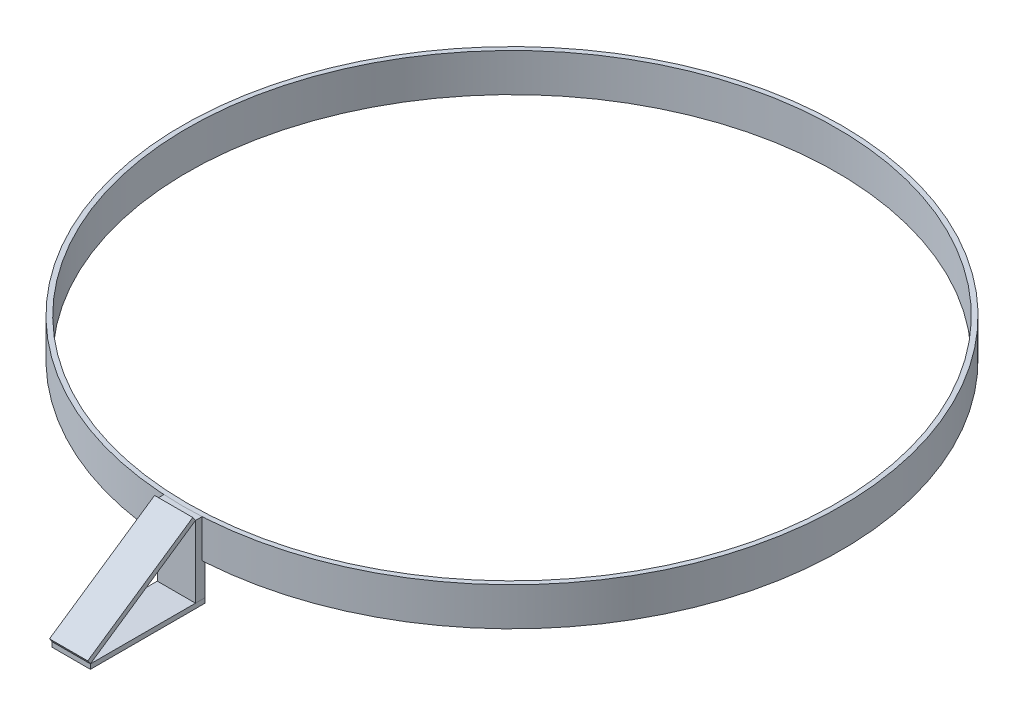
from build123d import *

# Parameters (mm, degrees)
SKETCH1_R            = 219.075
BOSS_EXTRUDE1_DEPTH  = 25.4
SKETCH2_R            = 215.9
CUT_EXTRUDE1_DEPTH   = 311.858281617
SKETCH7_W            = 25.4
SKETCH7_H            = 6.35
BOSS_EXTRUDE7_DEPTH  = 50.8
SKETCH13_W           = 25.4
SKETCH13_H           = 76.2
BOSS_EXTRUDE11_DEPTH = 3.175
SKETCH22_W           = 84.540896168
SKETCH22_H           = 25.4
BOSS_EXTRUDE12_DEPTH = 3.175


with BuildPart() as part:
    # Sketch1 → Boss-Extrude1 (new body)
    with BuildSketch(Plane(origin=(0, 0, 0), x_dir=(1, 0, 0), z_dir=(0, 1, 0))):
        with Locations(Location((0, 0, 0), (0, 0, 270))):
            Circle(SKETCH1_R)
    extrude(amount=BOSS_EXTRUDE1_DEPTH)

    # Sketch2 → Cut-Extrude1 (cut, through all)
    with BuildSketch(Plane(origin=(0, 25.4, 0), x_dir=(1, 0, 0), z_dir=(0, 1, 0))):
        with Locations(Location((0, 0, 0), (0, 0, 270))):
            Circle(SKETCH2_R)
    extrude(amount=-CUT_EXTRUDE1_DEPTH, mode=Mode.SUBTRACT)


with BuildPart() as body_2:
    # Sketch7 → Boss-Extrude7 (new body)
    with BuildSketch(Plane(origin=(0, -25.4, 0), x_dir=(1, 0, 0), z_dir=(0, 1, 0))):
        with Locations((0, -219.931380434)):
            Rectangle(SKETCH7_W, SKETCH7_H)
    extrude(amount=BOSS_EXTRUDE7_DEPTH)


with BuildPart() as body_3:
    # Sketch13 → Boss-Extrude11 (new body)
    with BuildSketch(Plane(origin=(0, -25.4, 0), x_dir=(1, 0, 0), z_dir=(0, 1, 0))):
        with Locations((0, -254.856380434)):
            Rectangle(SKETCH13_W, SKETCH13_H)
    extrude(amount=BOSS_EXTRUDE11_DEPTH)


with BuildPart() as body_4:
    # Sketch22 → Boss-Extrude12 (new body)
    with BuildSketch(Plane(origin=(0, 121.182941528, 82.62473286), x_dir=(0, -0.5633368246415097, 0.8262273428075478), z_dir=(0, 0.8262273428075478, 0.5633368246415097))):
        with Locations((212.298284608, 0)):
            Rectangle(SKETCH22_W, SKETCH22_H)
    extrude(amount=BOSS_EXTRUDE12_DEPTH)


solid = Compound([part.part, body_2.part, body_3.part, body_4.part])
